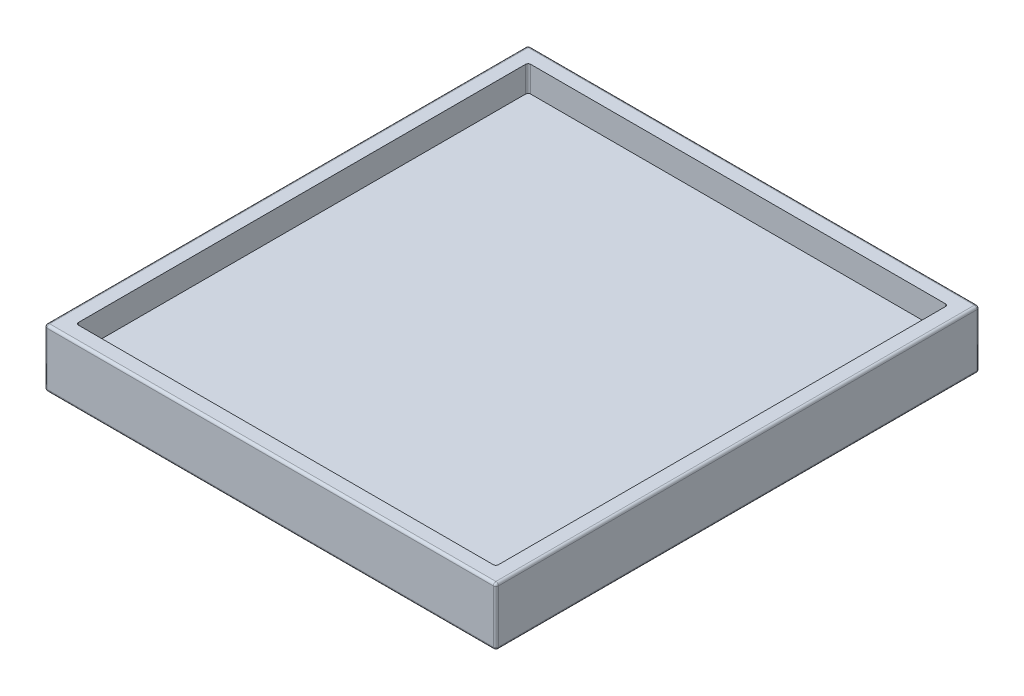
from build123d import *

# Parameters (mm, degrees)
SKETCH1_W           = 70
SKETCH1_H           = 75
BOSS_EXTRUDE1_DEPTH = 9
SKETCH2_W           = 65.1
SKETCH2_H           = 70.1
CUT_EXTRUDE1_DEPTH  = 4
SKETCH4_R           = 2.5
BOSS_EXTRUDE3_DEPTH = 7.5
FILLET1_R           = 0.4


with BuildPart() as part:
    # Sketch1 → Boss-Extrude1 (new body)
    with BuildSketch(Plane(origin=(0, 0, 0), x_dir=(1, 0, 0), z_dir=(0, 1, 0))):
        with Locations((35, 37.5)):
            Rectangle(SKETCH1_W, SKETCH1_H)
    extrude(amount=BOSS_EXTRUDE1_DEPTH)

    # Sketch2 → Cut-Extrude1 (cut)
    with BuildSketch(Plane(origin=(0, 9, 0), x_dir=(1, 0, 0), z_dir=(0, 1, 0))):
        with Locations((35, 37.5)):
            Rectangle(SKETCH2_W, SKETCH2_H)
    extrude(amount=-CUT_EXTRUDE1_DEPTH, mode=Mode.SUBTRACT)

    # Sketch4 → Boss-Extrude3 (add)
    with BuildSketch(Plane.XZ):
        with Locations(Location((17.5, -54, 0), (0, 0, 270))):
            Circle(SKETCH4_R)
        with Locations(Location((52.5, -54, 0), (0, 0, 90))):
            Circle(SKETCH4_R)
    extrude(amount=BOSS_EXTRUDE3_DEPTH)

    # Fillet1
    fillet1_edges = [part.edges().sort_by_distance(p)[0] for p in [
        (70, 9, -37.5),
        (35, 9, -75),
        (2.45, 7, -72.55),
        (2.45, 7, -2.45),
        (67.55, 7, -2.45),
        (67.55, 7, -72.55),
        (17.5, 0, -51.5),
        (17.5, -7.5, -51.5),
        (52.5, 0, -56.5),
        (52.5, -7.5, -56.5),
        (0, 9, -37.5),
        (35, 0, -75),
        (70, 0, -37.5),
        (35, 0, 0),
        (0, 0, -37.5),
        (0, 4.5, -75),
        (70, 4.5, -75),
        (70, 4.5, 0),
        (0, 4.5, 0),
        (35, 9, 0),
    ]]
    fillet(fillet1_edges, radius=FILLET1_R)


solid = part.part
